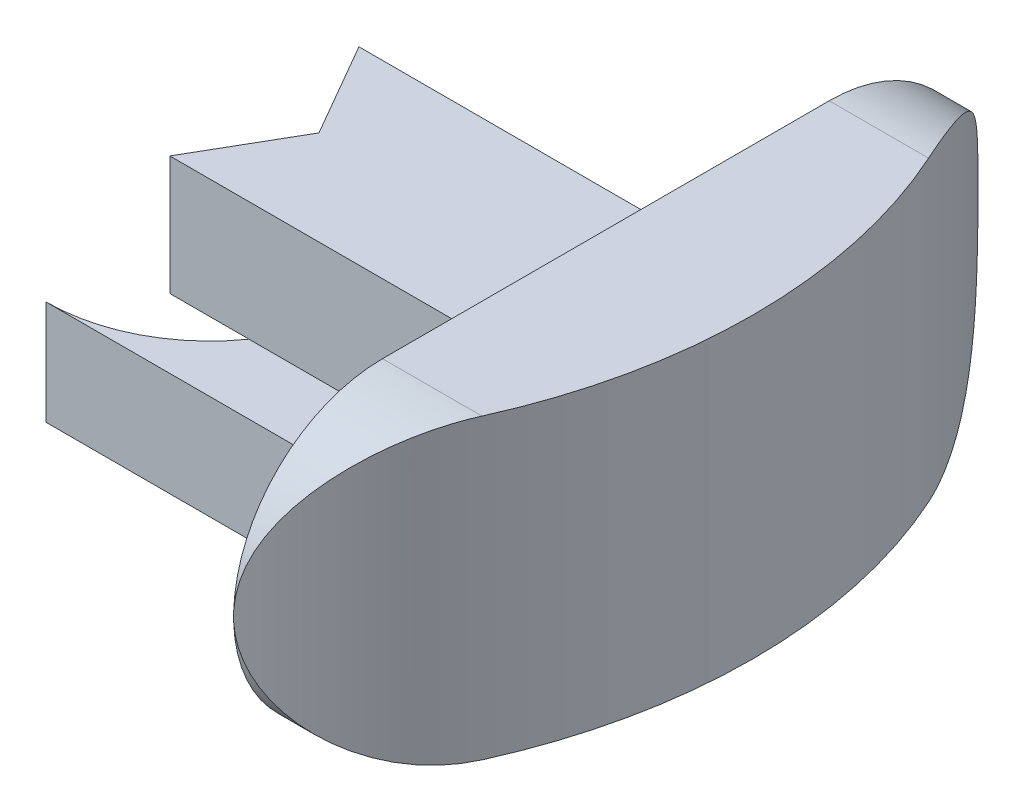
from build123d import *

# Parameters (mm, degrees)
BOSS_EXTRUDE1_DEPTH = 7
BOSS_EXTRUDE2_DEPTH = 8
BOSS_EXTRUDE3_DEPTH = 12
CUT_EXTRUDE1_REACH  = 52.149
SKETCH4_R           = 50
SKETCH4_R_2         = 36.5


with BuildPart() as part:
    # Sketch1 → Boss-Extrude1 (new body)
    with BuildSketch(Plane(origin=(0, 0, 0), x_dir=(1, 0, 0), z_dir=(0, 1, 0))):
        with BuildLine():
            Line((0, 11), (34.803017111, 11))
            ThreePointArc((34.803017111, 11), (36.5, 0), (34.803017111, -11))
            Line((34.803017111, -11), (0, -11))
            ThreePointArc((0, -11), (11, 0), (0, 11))
        make_face()
    extrude(amount=BOSS_EXTRUDE1_DEPTH)

    # Sketch2 → Boss-Extrude2 (add)
    with BuildSketch(Plane(origin=(0, 7, 0), x_dir=(1, 0, 0), z_dir=(0, 1, 0))):
        with BuildLine():
            Line((3.666174209, 6.35), (35.943392995, 6.35))
            ThreePointArc((35.943392995, 6.35), (36.5, 0), (35.943392995, -6.35))
            Line((35.943392995, -6.35), (3.666174209, -6.35))
            Line((3.666174209, -6.35), (7.332348419, 0))
            Line((7.332348419, 0), (3.666174209, 6.35))
        make_face()
    extrude(amount=BOSS_EXTRUDE2_DEPTH)

    # Sketch3 → Boss-Extrude3 (add)
    with BuildSketch(Plane(origin=(26.6, 0, 0), x_dir=(0, 0, -1), z_dir=(1, 0, 0))):
        with BuildLine():
            Line((-15, -1), (15, -1))
            ThreePointArc((15, -1), (25, 9), (15, 19))
            Line((15, 19), (-15, 19))
            ThreePointArc((-15, 19), (-25, 9), (-15, -1))
        make_face()
    extrude(amount=BOSS_EXTRUDE3_DEPTH)

    # Sketch4 → Cut-Extrude1 (cut, up to next)
    with BuildSketch(Plane(origin=(0, 19, 0), x_dir=(1, 0, 0), z_dir=(0, 1, 0)), mode=Mode.PRIVATE) as cut_extrude1_sk1:
        Circle(SKETCH4_R)
        Circle(SKETCH4_R_2, mode=Mode.SUBTRACT)
    cut_extrude1_tool1 = extrude(cut_extrude1_sk1.sketch, amount=-CUT_EXTRUDE1_REACH, mode=Mode.PRIVATE) & part.part
    add(cut_extrude1_tool1.solids().sort_by_distance((-48.585786, 19, 0))[0], mode=Mode.SUBTRACT)


solid = part.part
